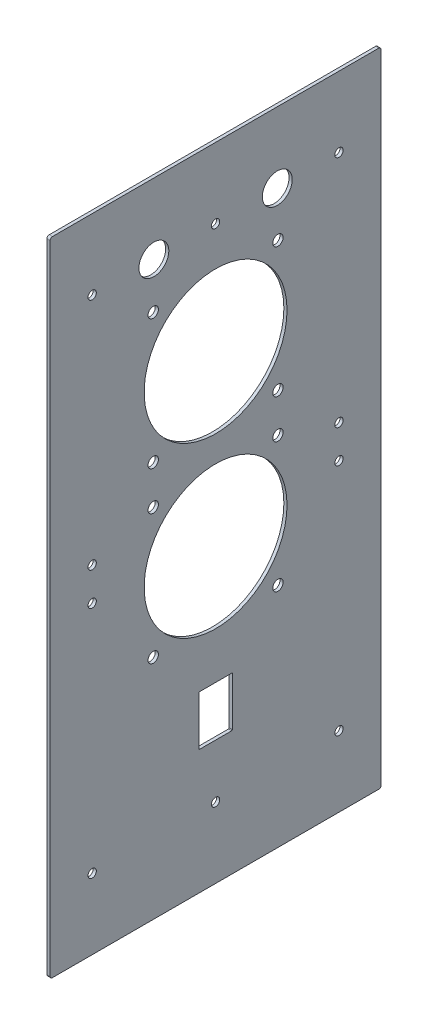
from build123d import *

# Parameters (mm, degrees)
BOSS_EXTRUDE1_DEPTH     = 1.22
CUT_EXTRUDE2_DEPTH      = 246.803551555
CUT_EXTRUDE2_DEPTH_BACK = 246.803551555
SKETCH5_R               = 1.6
SKETCH6_R               = 27.5
SKETCH6_R_2             = 2
CUT_EXTRUDE3_DEPTH      = 42
CUT_EXTRUDE4_DEPTH      = 246.803551555
SKETCH8_R               = 5.75
CUT_EXTRUDE5_DEPTH      = 246.803551555


with BuildPart() as part:
    # Sketch1 → Boss-Extrude1 (new body)
    with BuildSketch(Plane(origin=(0, 0, 0), x_dir=(0, 0, -1), z_dir=(1, 0, 0))):
        with BuildLine():
            Line((-62.8, 9.646), (62.8, 9.646))
            ThreePointArc((62.8, 9.646), (63.428617928, 9.385617928), (63.689, 8.757))
            Line((63.689, 8.757), (63.689, -236.517))
            ThreePointArc((63.689, -236.517), (63.428617928, -237.145617928), (62.8, -237.406))
            Line((62.8, -237.406), (-62.8, -237.406))
            ThreePointArc((-62.8, -237.406), (-63.428617928, -237.145617928), (-63.689, -236.517))
            Line((-63.689, -236.517), (-63.689, 8.757))
            ThreePointArc((-63.689, 8.757), (-63.428617928, 9.385617928), (-62.8, 9.646))
        make_face()
    extrude(amount=BOSS_EXTRUDE1_DEPTH)

    # Sketch5 → Cut-Extrude2 (cut, two sides: drawn at the far end of the back side and taken through both)
    with BuildSketch(Plane(origin=(0, 0, 0), x_dir=(0, 0, -1), z_dir=(1, 0, 0)).offset(-CUT_EXTRUDE2_DEPTH_BACK)):
        with Locations((-47.5, -17.5)):
            Circle(SKETCH5_R)
        with Locations((0, -17.5)):
            Circle(SKETCH5_R)
        with Locations((47.5, -17.5)):
            Circle(SKETCH5_R)
        with Locations((-47.5, -107.5)):
            Circle(SKETCH5_R)
        with Locations((47.5, -107.5)):
            Circle(SKETCH5_R)
        with Locations((47.5, -120.26)):
            Circle(SKETCH5_R)
        with Locations((-47.5, -120.26)):
            Circle(SKETCH5_R)
        with Locations((47.5, -210.26)):
            Circle(SKETCH5_R)
        with Locations((0, -210.26)):
            Circle(SKETCH5_R)
        with Locations((-47.5, -210.26)):
            Circle(SKETCH5_R)
    extrude(amount=CUT_EXTRUDE2_DEPTH + CUT_EXTRUDE2_DEPTH_BACK, mode=Mode.SUBTRACT)

    # Sketch6 → Cut-Extrude3 (cut)
    with BuildSketch(Plane(origin=(0, 0, 0), x_dir=(0, 0, -1), z_dir=(1, 0, 0))):
        with Locations((0, -60)):
            Circle(SKETCH6_R)
        with Locations((0, -125)):
            Circle(SKETCH6_R)
        with Locations((24, -35)):
            Circle(SKETCH6_R_2)
        with Locations((-24, -35)):
            Circle(SKETCH6_R_2)
        with Locations((-24, -85)):
            Circle(SKETCH6_R_2)
        with Locations((24, -85)):
            Circle(SKETCH6_R_2)
        with Locations((24, -100)):
            Circle(SKETCH6_R_2)
        with Locations((-24, -100)):
            Circle(SKETCH6_R_2)
        with Locations((-24, -150)):
            Circle(SKETCH6_R_2)
        with Locations((24, -150)):
            Circle(SKETCH6_R_2)
    extrude(amount=CUT_EXTRUDE3_DEPTH, mode=Mode.SUBTRACT)

    # Sketch7 → Cut-Extrude4 (cut, through all)
    with BuildSketch(Plane(origin=(0, 0, 0), x_dir=(0, 0, -1), z_dir=(1, 0, 0))):
        with BuildLine():
            Line((-6.2, -189.6), (6.2, -189.6))
            ThreePointArc((6.2, -189.6), (6.376776695, -189.526776695), (6.45, -189.35))
            Line((6.45, -189.35), (6.45, -170.65))
            ThreePointArc((6.45, -170.65), (6.376776695, -170.473223305), (6.2, -170.4))
            Line((6.2, -170.4), (-6.2, -170.4))
            ThreePointArc((-6.2, -170.4), (-6.376776695, -170.473223305), (-6.45, -170.65))
            Line((-6.45, -170.65), (-6.45, -189.35))
            ThreePointArc((-6.45, -189.35), (-6.376776695, -189.526776695), (-6.2, -189.6))
        make_face()
    extrude(amount=CUT_EXTRUDE4_DEPTH, mode=Mode.SUBTRACT)

    # Sketch8 → Cut-Extrude5 (cut, through all)
    with BuildSketch(Plane(origin=(1.22, 0, 0), x_dir=(0, 0, -1), z_dir=(1, 0, 0))):
        with Locations((-23.75, -17.5)):
            Circle(SKETCH8_R)
        with Locations((23.75, -17.5)):
            Circle(SKETCH8_R)
    extrude(amount=-CUT_EXTRUDE5_DEPTH, mode=Mode.SUBTRACT)


solid = part.part
